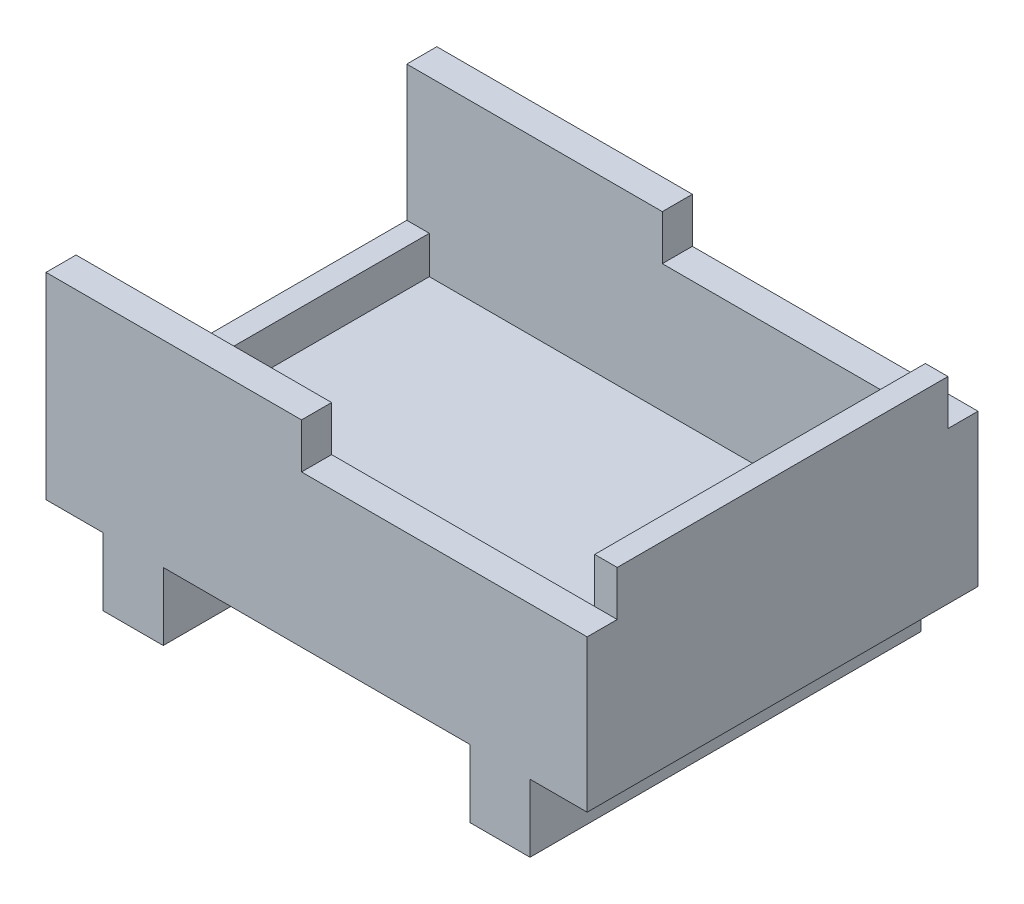
from build123d import *

# Parameters (mm, degrees)
SKETCH_1_W          = 36
SKETCH_1_H          = 26
EXTRUDE_1_DEPTH     = 14.6
SKETCH_2_W          = 33
SKETCH_2_H          = 22
CUT_EXTRUDE_1_DEPTH = 13
SKETCH_3_W          = 36
SKETCH_3_H          = 26
CUT_EXTRUDE_2_DEPTH = 4.5
SKETCH_4_W          = 1.5
SKETCH_4_H          = 22
CUT_EXTRUDE_3_DEPTH = 6
SKETCH_7_W          = 17
SKETCH_7_H          = 2
SKETCH_7_W_2        = 1.5
SKETCH_7_H_2        = 22
EXTRUDE_4_DEPTH     = 3
SKETCH_5_W          = 4
SKETCH_5_H          = 3
EXTRUDE_5_DEPTH     = 2
SKETCH_8_W          = 4
SKETCH_8_H          = 26
EXTRUDE_6_DEPTH     = 2.5


with BuildPart() as part:
    # 草图1 → 凸台-拉伸1 (new body)
    with BuildSketch(Plane(origin=(0, 0, 0), x_dir=(1, 0, 0), z_dir=(0, 1, 0))):
        Rectangle(SKETCH_1_W, SKETCH_1_H)
    extrude(amount=EXTRUDE_1_DEPTH)

    # 草图2 → 切除-拉伸1 (cut)
    with BuildSketch(Plane(origin=(0, 14.6, 0), x_dir=(1, 0, 0), z_dir=(0, 1, 0))):
        Rectangle(SKETCH_2_W, SKETCH_2_H)
    extrude(amount=-CUT_EXTRUDE_1_DEPTH, mode=Mode.SUBTRACT)

    # 草图3 → 切除-拉伸2 (cut)
    with BuildSketch(Plane(origin=(0, 14.6, 0), x_dir=(1, 0, 0), z_dir=(0, 1, 0))):
        Rectangle(SKETCH_3_W, SKETCH_3_H)
    extrude(amount=-CUT_EXTRUDE_2_DEPTH, mode=Mode.SUBTRACT)

    # 草图4 → 切除-拉伸3 (cut)
    with BuildSketch(Plane(origin=(0, 10.1, 0), x_dir=(1, 0, 0), z_dir=(0, 1, 0))):
        with Locations((-17.25, 0)):
            Rectangle(SKETCH_4_W, SKETCH_4_H)
    extrude(amount=-CUT_EXTRUDE_3_DEPTH, mode=Mode.SUBTRACT)

    # 草图7 → 凸台-拉伸4 (add)
    with BuildSketch(Plane(origin=(0, 10.1, 0), x_dir=(1, 0, 0), z_dir=(0, 1, 0))):
        with Locations((-9.5, 12)):
            Rectangle(SKETCH_7_W, SKETCH_7_H)
        with Locations((-9.5, -12)):
            Rectangle(SKETCH_7_W, SKETCH_7_H)
        with Locations((17.25, 0)):
            Rectangle(SKETCH_7_W_2, SKETCH_7_H_2)
    extrude(amount=EXTRUDE_4_DEPTH)

    # 草图5 → 凸台-拉伸5 (add)
    with BuildSketch(Plane(origin=(0, 0, 0), x_dir=(-1, 0, 0), z_dir=(0, -1, 0))):
        with Locations((-12.2, -11.5)):
            Rectangle(SKETCH_5_W, SKETCH_5_H)
        with Locations((12.2, -11.5)):
            Rectangle(SKETCH_5_W, SKETCH_5_H)
        with Locations((-12.2, 11.5)):
            Rectangle(SKETCH_5_W, SKETCH_5_H)
        with Locations((12.2, 11.5)):
            Rectangle(SKETCH_5_W, SKETCH_5_H)
    extrude(amount=EXTRUDE_5_DEPTH)

    # 草图8 → 凸台-拉伸6 (add)
    with BuildSketch(Plane(origin=(0, -2, 0), x_dir=(-1, 0, 0), z_dir=(0, -1, 0))):
        with Locations((-12.2, 0)):
            Rectangle(SKETCH_8_W, SKETCH_8_H)
        with Locations((12.2, 0)):
            Rectangle(SKETCH_8_W, SKETCH_8_H)
    extrude(amount=EXTRUDE_6_DEPTH)


solid = part.part
